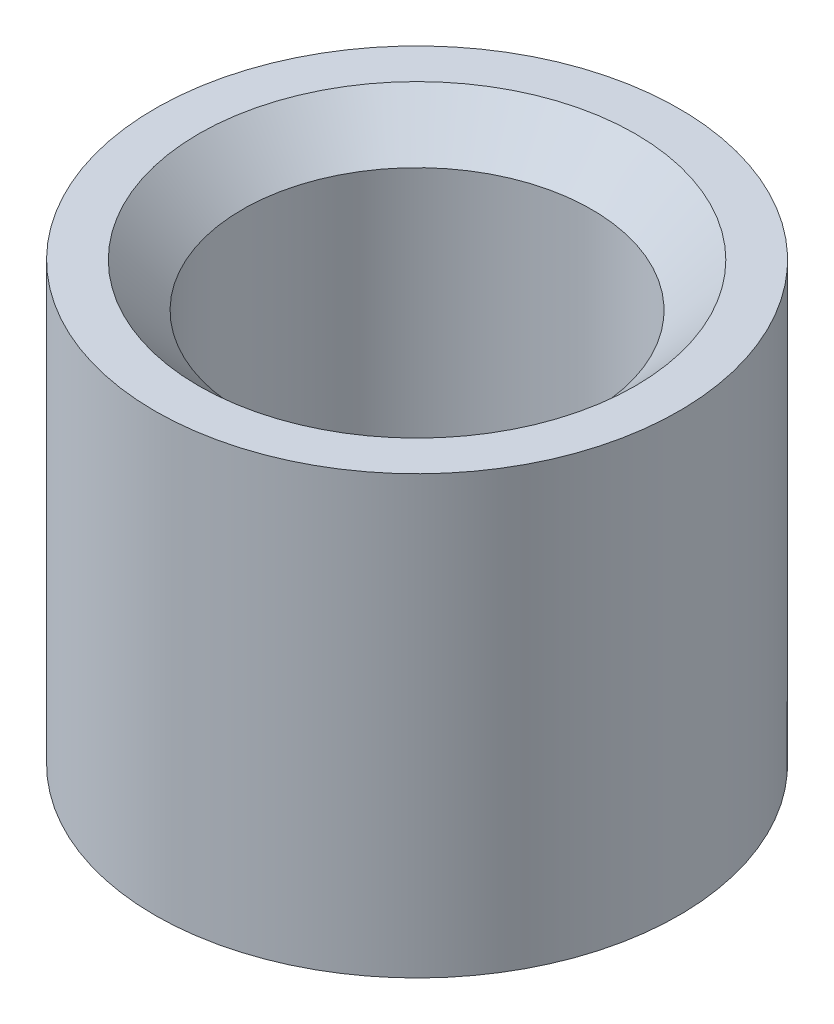
from build123d import *

# Parameters (mm, degrees)
SCHIZZO1_R                   = 6
SCHIZZO1_R_2                 = 4
ESTRUSIONE_ESTRUSIONE1_DEPTH = 10
SMUSSO1_SIZE                 = 1


with BuildPart() as part:
    # Schizzo1 → Estrusione-Estrusione1 (new body)
    with BuildSketch(Plane(origin=(0, 0, 0), x_dir=(1, 0, 0), z_dir=(0, 1, 0))):
        with Locations(Location((0, 0, 0), (0, 0, 270))):
            Circle(SCHIZZO1_R)
        with Locations(Location((0, 0, 0), (0, 0, 270))):
            Circle(SCHIZZO1_R_2, mode=Mode.SUBTRACT)
    extrude(amount=ESTRUSIONE_ESTRUSIONE1_DEPTH)

    # Smusso1
    smusso1_edges = [part.edges().sort_by_distance(p)[0] for p in [
        (0, 10, -4),
    ]]
    chamfer(smusso1_edges, length=SMUSSO1_SIZE)


solid = part.part
